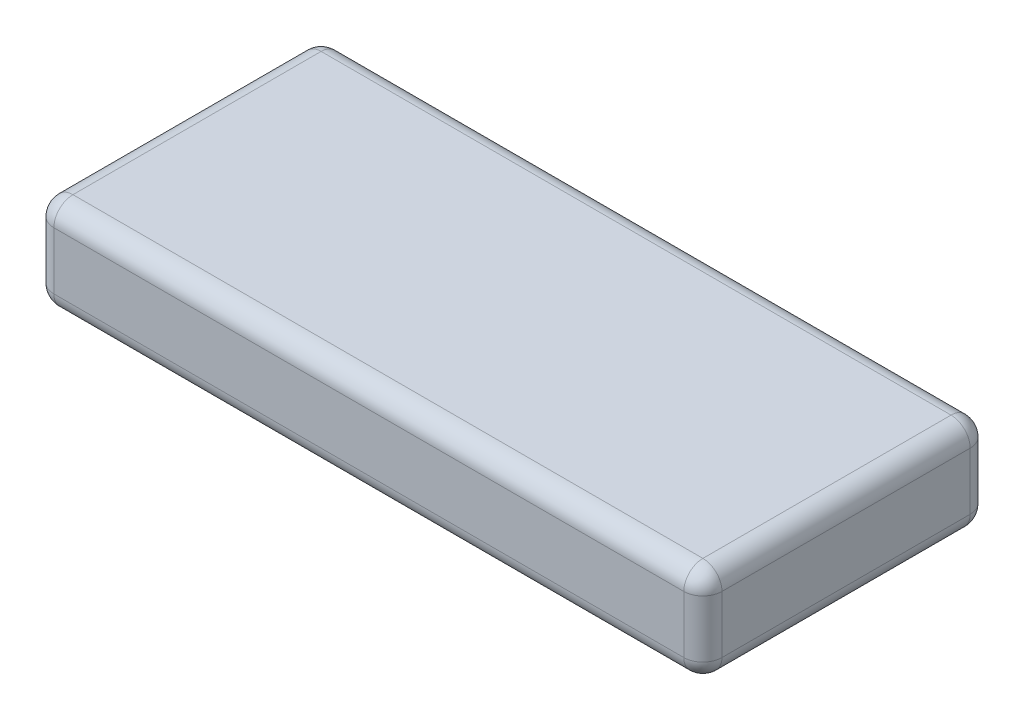
from build123d import *

# Parameters (mm, degrees)
SKETCH1_W           = 70
SKETCH1_H           = 30
BOSS_EXTRUDE1_DEPTH = 10
FILLET1_R           = 2


with BuildPart() as part:
    # Sketch1 → Boss-Extrude1 (new body)
    with BuildSketch(Plane(origin=(0, 0, 0), x_dir=(1, 0, 0), z_dir=(0, 1, 0))):
        Rectangle(SKETCH1_W, SKETCH1_H)
    extrude(amount=BOSS_EXTRUDE1_DEPTH)

    # Fillet1
    fillet1_edges = [part.edges().sort_by_distance(p)[0] for p in [
        (-35, 10, 0),
        (0, 10, 15),
        (35, 10, 0),
        (0, 0, 15),
        (-35, 0, 0),
        (0, 0, -15),
        (35, 0, 0),
        (35, 5, 15),
        (-35, 5, 15),
        (-35, 5, -15),
        (35, 5, -15),
        (0, 10, -15),
    ]]
    fillet(fillet1_edges, radius=FILLET1_R)


solid = part.part
